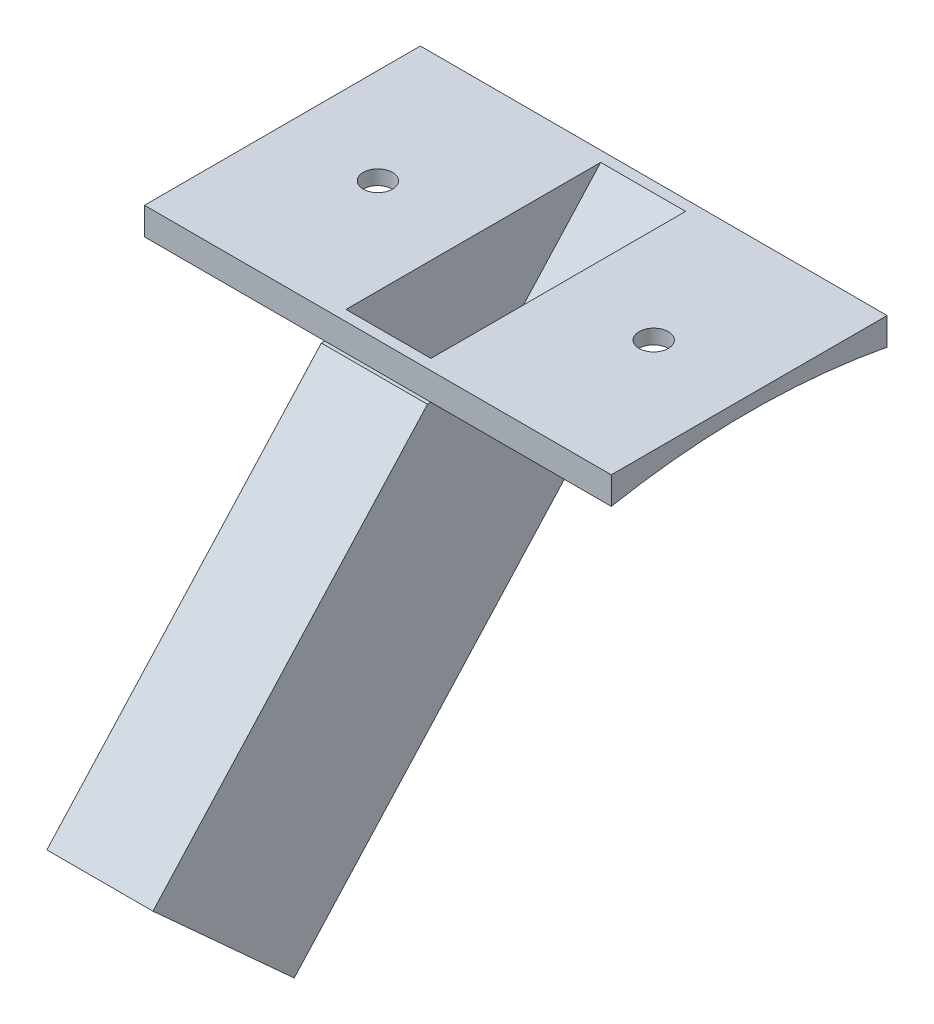
from build123d import *

# Parameters (mm, degrees)
SKETCH18_W                = 18
SKETCH18_H                = 26
SKETCH18_R                = 1.375
BOSS_EXTRUDE1_DEPTH       = 2.58
SKETCH19_W                = 1
SKETCH19_H                = 2.58
BOSS_EXTRUDE2_DEPTH       = 8
SKETCH20_W                = 26
SKETCH20_H                = 2.58
BOSS_EXTRUDE3_DEPTH       = 18
SKETCH21_R                = 1.375
CUT_EXTRUDE1_DEPTH        = 18
BOSS_EXTRUDE12_DEPTH      = 1
BOSS_EXTRUDE13_DEPTH      = 8
BOSS_EXTRUDE13_DEPTH_BACK = 1
SKETCH27_W                = 8
SKETCH27_H                = 1
BOSS_EXTRUDE14_DEPTH      = 2.5
SKETCH28_W                = 8
SKETCH28_H                = 1
BOSS_EXTRUDE15_DEPTH      = 2.5
BOSS_EXTRUDE16_DEPTH      = 1
BOSS_EXTRUDE17_DEPTH      = 9
SKETCH31_R                = 70
CUT_EXTRUDE8_DEPTH        = 17
SKETCH22_R                = 70
CUT_EXTRUDE9_DEPTH        = 17


with BuildPart() as part:
    # Sketch18 → Boss-Extrude1 (new body)
    with BuildSketch(Plane(origin=(0, 0, 0), x_dir=(1, 0, 0), z_dir=(0, 1, 0))):
        with Locations((9, 13)):
            Rectangle(SKETCH18_W, SKETCH18_H)
        with Locations((9, 13)):
            Circle(SKETCH18_R, mode=Mode.SUBTRACT)
    extrude(amount=BOSS_EXTRUDE1_DEPTH)

    # Sketch19 → Boss-Extrude2 (add)
    with BuildSketch(Plane(origin=(18, 0, 0), x_dir=(0, 0, -1), z_dir=(1, 0, 0))):
        with Locations((0.5, 1.29)):
            Rectangle(SKETCH19_W, SKETCH19_H)
        with Locations((25.5, 1.29)):
            Rectangle(SKETCH19_W, SKETCH19_H)
    extrude(amount=BOSS_EXTRUDE2_DEPTH)

    # Sketch20 → Boss-Extrude3 (add)
    with BuildSketch(Plane(origin=(26, 0, 0), x_dir=(0, 0, -1), z_dir=(1, 0, 0))):
        with Locations((13, 1.29)):
            Rectangle(SKETCH20_W, SKETCH20_H)
    extrude(amount=BOSS_EXTRUDE3_DEPTH)

    # Sketch21 → Cut-Extrude1 (cut)
    with BuildSketch(Plane(origin=(0, 2.58, 0), x_dir=(1, 0, 0), z_dir=(0, 1, 0))):
        with Locations((35, 13)):
            Circle(SKETCH21_R)
    extrude(amount=-CUT_EXTRUDE1_DEPTH, mode=Mode.SUBTRACT)

    # Sketch26<3> → Boss-Extrude13 (add, two sides: drawn at the far end of the back side and taken through both)
    with BuildSketch(Plane.ZY.offset(-26).offset(-BOSS_EXTRUDE13_DEPTH_BACK)):
        Polygon((4.34485947, -4.414818386), (3.605141162, -5.087735041), (25.459541086, -29.111660746), (26.199259394, -28.438744091), align=None)
        Polygon((13.62404816, -39.878327231), (-25, 2.58), (-25, 1.093931863), (12.884329852, -40.551243886), align=None)
    extrude(amount=BOSS_EXTRUDE13_DEPTH + BOSS_EXTRUDE13_DEPTH_BACK)


with BuildPart() as body_2:
    # Sketch26 → Boss-Extrude12 (new body)
    with BuildSketch(Plane.ZY.offset(-26)):
        Polygon((-1.0231364, 0), (-19.42564271, 0), (-21.280747396, 0), (-22.652991751, 0), (13.62404816, -39.878327231), (25.459541086, -29.111660746), (3.605141162, -5.087735041), align=None)
    extrude(amount=-BOSS_EXTRUDE12_DEPTH)



with BuildPart() as boss_extrude13_piece_1:
    # of the separate pieces the step leaves, piece 1, a body of its own (boss_extrude13_pieces)
    add(part.part.solids().sort_by_distance((0, 0, 0))[0])


with BuildPart() as boss_extrude13_piece_2:
    # of the separate pieces the step leaves, piece 2, a body of its own (boss_extrude13_pieces)
    add(part.part.solids().sort_by_distance((18, -5.087735041, 3.605141162))[0])


with BuildPart() as body_2_1:
    add(body_2.part)

    add(boss_extrude13_piece_2.part)  # Boss-Extrude14 merges Boss-Extrude13 piece 2
    # Sketch27 → Boss-Extrude14 (add)
    with BuildSketch(Plane(origin=(0, -0.509285347, -0.559843024), x_dir=(-1, 0, 0), z_dir=(0, -0.6729166552839775, -0.7397183078993143))):
        with Locations((-22, -38.16657766)):
            Rectangle(SKETCH27_W, SKETCH27_H)
    extrude(amount=BOSS_EXTRUDE14_DEPTH)


    add(boss_extrude13_piece_1.part)  # Boss-Extrude15 merges Boss-Extrude13 piece 1
    # Sketch28 → Boss-Extrude15 (add)
    with BuildSketch(Plane(origin=(0, -11.275951832, -12.39533595), x_dir=(1, 0, 0), z_dir=(0, 0.6729166552839719, 0.7397183078993194))):
        with Locations((22, -38.16657766)):
            Rectangle(SKETCH28_W, SKETCH28_H)
    extrude(amount=BOSS_EXTRUDE15_DEPTH)

    # Sketch29 → Boss-Extrude16 (add)
    with BuildSketch(Plane.ZY.offset(-18)):
        Polygon((-24.00485771, 0), (12.884329852, -40.551243886), (26.199259394, -28.438744091), (0.328729559, 0), align=None)
    extrude(amount=BOSS_EXTRUDE16_DEPTH)

    # Sketch32 → Boss-Extrude17 (add)
    with BuildSketch(Plane(origin=(18, 0, 0), x_dir=(0, 0, -1), z_dir=(1, 0, 0))):
        Polygon((-4.34485947, -4.414818386), (-3.605141162, -5.087735041), (1.0231364, 0), (-0.328729559, 0), align=None)
    extrude(amount=BOSS_EXTRUDE17_DEPTH)

    # Sketch31 → Cut-Extrude8 (cut)
    with BuildSketch(Plane.ZY.offset(-17)):
        with Locations((-13, -68.782265156)):
            Circle(SKETCH31_R)
    extrude(amount=CUT_EXTRUDE8_DEPTH, mode=Mode.SUBTRACT)

    # Sketch22 → Cut-Extrude9 (cut)
    with BuildSketch(Plane(origin=(44, 0, 0), x_dir=(0, 0, -1), z_dir=(1, 0, 0))):
        with Locations((13, -68.782265156)):
            Circle(SKETCH22_R)
    extrude(amount=-CUT_EXTRUDE9_DEPTH, mode=Mode.SUBTRACT)


solid = body_2_1.part
